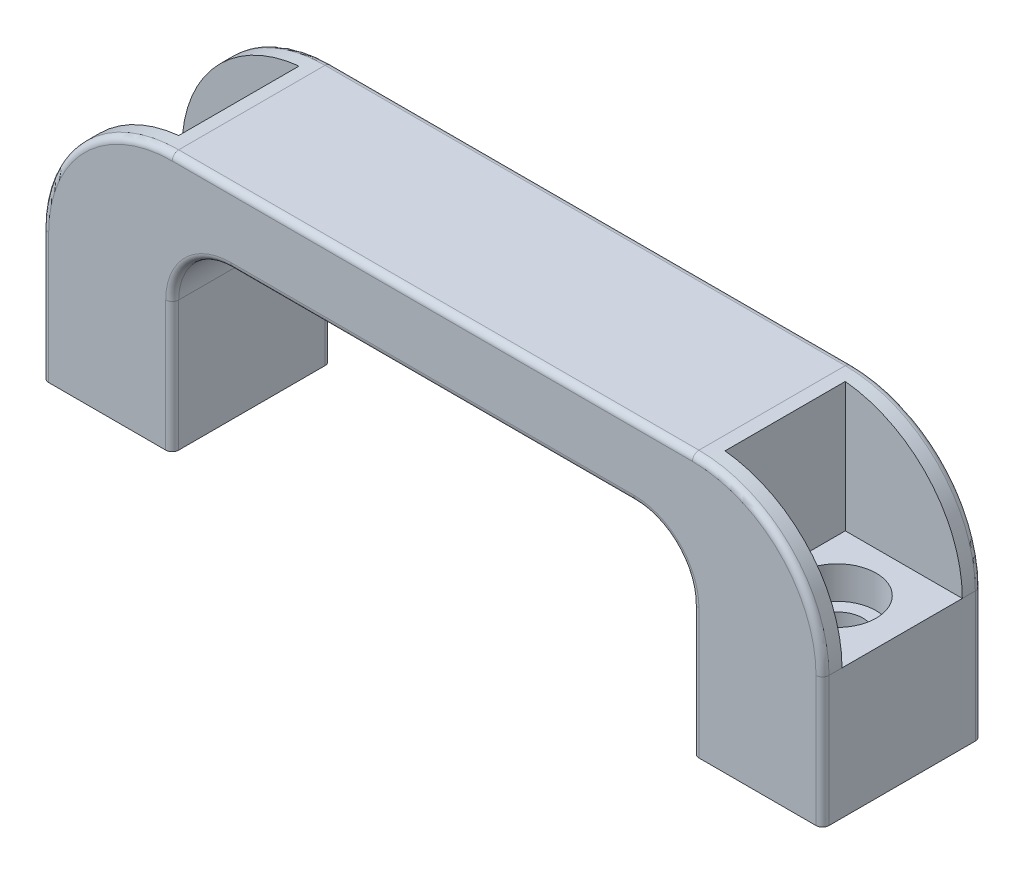
from build123d import *

# Parameters (mm, degrees)
EXTRUDE_1_DEPTH     = 24.5
FILLET_1_R          = 20
FILLET_2_R          = 9
SKETCH_2_W          = 18.5
SKETCH_2_H          = 26.060105981
CUT_EXTRUDE_1_DEPTH = 18
SKETCH_3_W          = 18.5
SKETCH_3_H          = 21.487076152
CUT_EXTRUDE_2_DEPTH = 18
FILLET_3_R          = 1
SKETCH_6_R          = 4
CUT_EXTRUDE_3_DEPTH = 129.841957452
SKETCH_7_R          = 6
CUT_EXTRUDE_4_DEPTH = 5


with BuildPart() as part:
    # Эскиз1 → Бобышка-Вытянуть1 (new body)
    with BuildSketch(Plane.XY):
        Polygon((0, 0), (0, 40), (120, 40), (120, 0), (100, 0), (100, 29), (20, 29), (20, 0), align=None)
    extrude(amount=EXTRUDE_1_DEPTH)

    # Скругление1
    fillet_1_edges = [part.edges().sort_by_distance(p)[0] for p in [
        (0, 40, 12.25),
        (120, 40, 12.25),
    ]]
    fillet(fillet_1_edges, radius=FILLET_1_R)

    # Скругление2
    fillet_2_edges = [part.edges().sort_by_distance(p)[0] for p in [
        (100, 29, 12.25),
        (20, 29, 12.25),
    ]]
    fillet(fillet_2_edges, radius=FILLET_2_R)

    # Эскиз2 → Вырез-Вытянуть1 (cut)
    with BuildSketch(Plane(origin=(120, 0, 0), x_dir=(0, 0, -1), z_dir=(1, 0, 0))):
        with Locations((-12.25, 33.03005299)):
            Rectangle(SKETCH_2_W, SKETCH_2_H)
    extrude(amount=-CUT_EXTRUDE_1_DEPTH, mode=Mode.SUBTRACT)

    # Эскиз3 → Вырез-Вытянуть2 (cut)
    with BuildSketch(Plane.ZY):
        with Locations((12.25, 30.743538076)):
            Rectangle(SKETCH_3_W, SKETCH_3_H)
    extrude(amount=-CUT_EXTRUDE_2_DEPTH, mode=Mode.SUBTRACT)

    # Скругление3
    fillet_3_edges = [part.edges().sort_by_distance(p)[0] for p in [
        (20, 10, 0),
        (120, 10, 24.5),
        (0, 10, 0),
        (0, 10, 24.5),
        (60, 40, 0),
        (114.142135624, 34.142135624, 0),
        (5.857864376, 34.142135624, 0),
        (60, 40, 24.5),
        (114.142135624, 34.142135624, 24.5),
        (5.857864376, 34.142135624, 24.5),
        (60, 29, 0),
        (60, 29, 24.5),
        (100, 10, 0),
        (100, 10, 24.5),
        (22.636038969, 26.363961031, 0),
        (22.636038969, 26.363961031, 24.5),
        (97.363961031, 26.363961031, 0),
        (97.363961031, 26.363961031, 24.5),
        (20, 10, 24.5),
        (120, 10, 0),
    ]]
    fillet(fillet_3_edges, radius=FILLET_3_R)

    # Эскиз6 → Вырез-Вытянуть3 (cut, through all)
    with BuildSketch(Plane(origin=(0, 0, 0), x_dir=(-1, 0, 0), z_dir=(0, -1, 0))):
        with Locations(Location((-10, -12.25, 0), (0, 0, 180))):
            Circle(SKETCH_6_R)
        with Locations(Location((-110, -12.25, 0), (0, 0, 180))):
            Circle(SKETCH_6_R)
    extrude(amount=-CUT_EXTRUDE_3_DEPTH, mode=Mode.SUBTRACT)

    # Эскиз7 → Вырез-Вытянуть4 (cut)
    with BuildSketch(Plane(origin=(0, 20, 0), x_dir=(1, 0, 0), z_dir=(0, 1, 0))):
        with Locations(Location((10, -12.25, 0), (0, 0, 270))):
            Circle(SKETCH_7_R)
        with Locations(Location((110, -12.25, 0), (0, 0, 270))):
            Circle(SKETCH_7_R)
    extrude(amount=-CUT_EXTRUDE_4_DEPTH, mode=Mode.SUBTRACT)


solid = part.part
